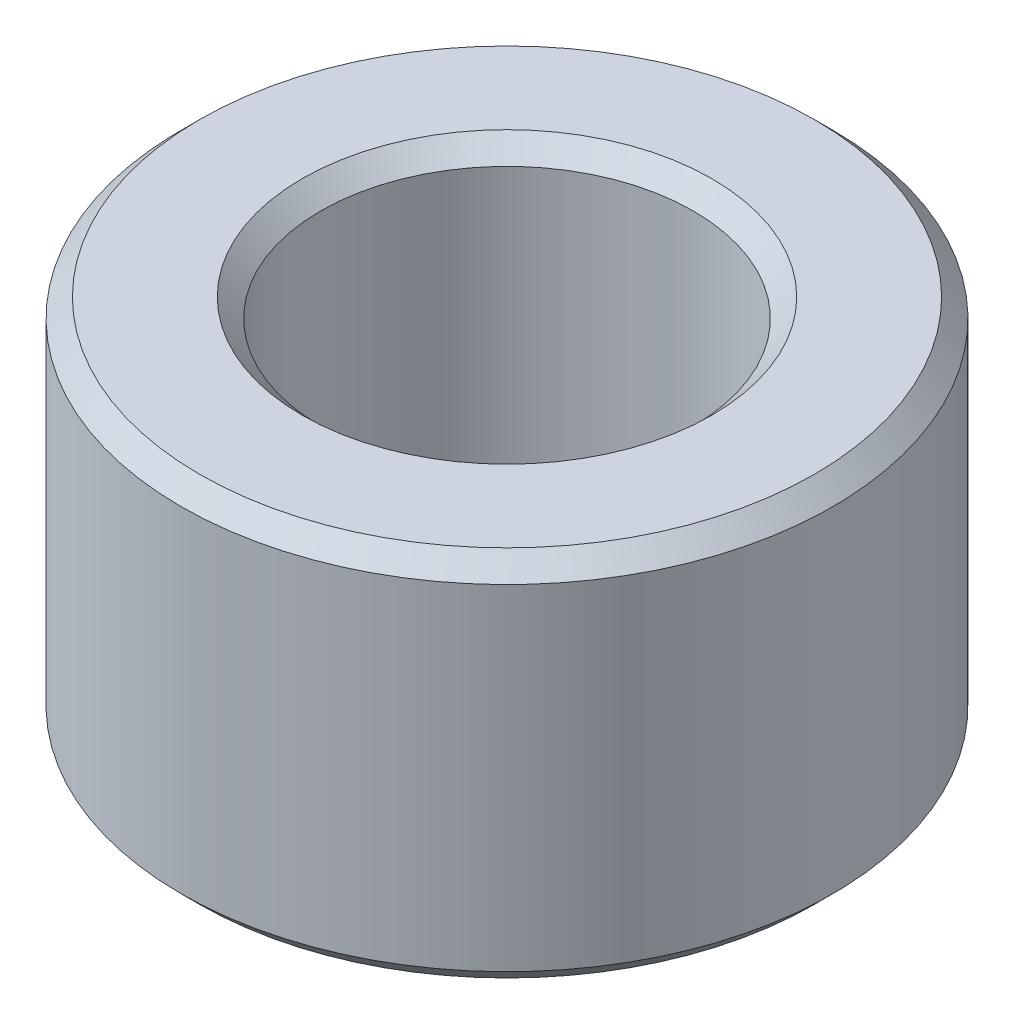
from build123d import *

# Parameters (mm, degrees)
SZKIC1_R                    = 3.5
SZKIC1_R_2                  = 2
DODANIE_WYCI_GNI_CIE1_DEPTH = 4
SFAZOWANIE1_SIZE            = 0.2


with BuildPart() as part:
    # Szkic1 → Dodanie-wyciągnięcie1 (new body)
    with BuildSketch(Plane(origin=(0, 0, 0), x_dir=(1, 0, 0), z_dir=(0, 1, 0))):
        with Locations(Location((0, 0, 0), (0, 0, 270))):
            Circle(SZKIC1_R)
        with Locations(Location((0, 0, 0), (0, 0, 270))):
            Circle(SZKIC1_R_2, mode=Mode.SUBTRACT)
    extrude(amount=DODANIE_WYCI_GNI_CIE1_DEPTH)

    # Sfazowanie1
    sfazowanie1_edges = [part.edges().sort_by_distance(p)[0] for p in [
        (0, 0, -3.5),
        (0, 4, -3.5),
        (0, 0, -2),
        (0, 4, -2),
    ]]
    chamfer(sfazowanie1_edges, length=SFAZOWANIE1_SIZE)


solid = part.part
